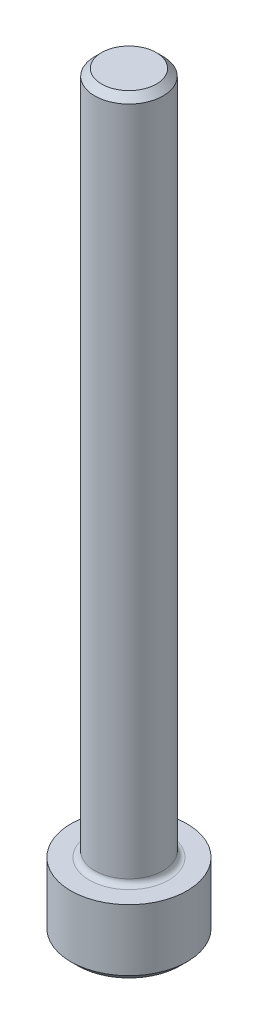
from build123d import *

# Parameters (mm, degrees)
SKETCH2_R           = 2.5
BOSS_EXTRUDE1_DEPTH = 50
SKETCH3_R           = 4.25
BOSS_EXTRUDE2_DEPTH = 5
FILLET1_R           = 0.4
CHAMFER1_SIZE       = 0.5
CUT_EXTRUDE1_DEPTH  = 2.5


with BuildPart() as part:
    # Sketch2 → Boss-Extrude1 (new body)
    with BuildSketch(Plane(origin=(0, 0, 0), x_dir=(1, 0, 0), z_dir=(0, 1, 0))):
        with Locations(Location((0, 0, 0), (0, 0, 270))):
            Circle(SKETCH2_R)
    extrude(amount=BOSS_EXTRUDE1_DEPTH)

    # Sketch3 → Boss-Extrude2 (add)
    with BuildSketch(Plane(origin=(0, 0, 0), x_dir=(1, 0, 0), z_dir=(0, 1, 0))):
        with Locations(Location((0, 0, 0), (0, 0, 270))):
            Circle(SKETCH3_R)
    extrude(amount=-BOSS_EXTRUDE2_DEPTH)

    # Fillet1
    fillet1_edges = [part.edges().sort_by_distance(p)[0] for p in [
        (0, 0, -2.5),
    ]]
    fillet(fillet1_edges, radius=FILLET1_R)

    # Chamfer1
    chamfer1_edges = [part.edges().sort_by_distance(p)[0] for p in [
        (0, 50, -2.5),
        (0, -5, -4.25),
    ]]
    chamfer(chamfer1_edges, length=CHAMFER1_SIZE)

    # Sketch4 → Cut-Extrude1 (cut)
    with BuildSketch(Plane.XZ.offset(5)):
        Polygon((0, 2.309401077), (-2, 1.154700538), (-2, -1.154700538), (0, -2.309401077), (2, -1.154700538), (2, 1.154700538), align=None)
    extrude(amount=-CUT_EXTRUDE1_DEPTH, mode=Mode.SUBTRACT)


solid = part.part
